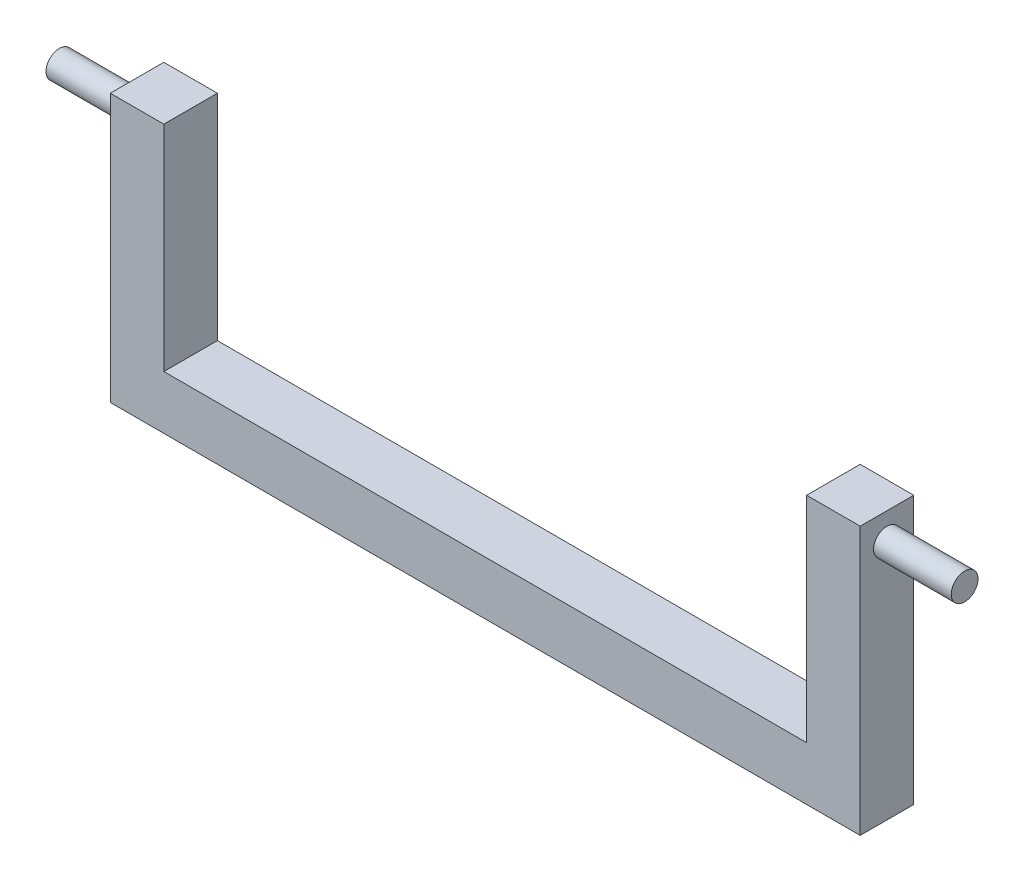
from build123d import *

# Parameters (mm, degrees)
BOSS_EXTRUDE1_DEPTH = 5
SKETCH2_R           = 2.5
BOSS_EXTRUDE2_DEPTH = 7.25
SKETCH3_R           = 2.5
BOSS_EXTRUDE3_DEPTH = 7.25


with BuildPart() as part:
    # Sketch1 → Boss-Extrude1 (new, symmetric)
    with BuildSketch(Plane.XY.offset(190)):
        Polygon((-70, 2), (70, 2), (70, 52), (60, 52), (60, 12), (-60, 12), (-60, 52), (-70, 52), align=None)
    extrude(amount=BOSS_EXTRUDE1_DEPTH, both=True)

    # Sketch2 → Boss-Extrude2 (add, symmetric)
    with BuildSketch(Plane(origin=(-77.25, 0, 0), x_dir=(0, 0, -1), z_dir=(1, 0, 0))):
        with Locations(Location((-190, 47, 0), (0, 0, 180))):
            Circle(SKETCH2_R)
    extrude(amount=BOSS_EXTRUDE2_DEPTH, both=True)

    # Sketch3 → Boss-Extrude3 (add, symmetric)
    with BuildSketch(Plane(origin=(77.25, 0, 0), x_dir=(0, 0, -1), z_dir=(1, 0, 0))):
        with Locations(Location((-190, 47, 0), (0, 0, 180))):
            Circle(SKETCH3_R)
    extrude(amount=BOSS_EXTRUDE3_DEPTH, both=True)


solid = part.part
